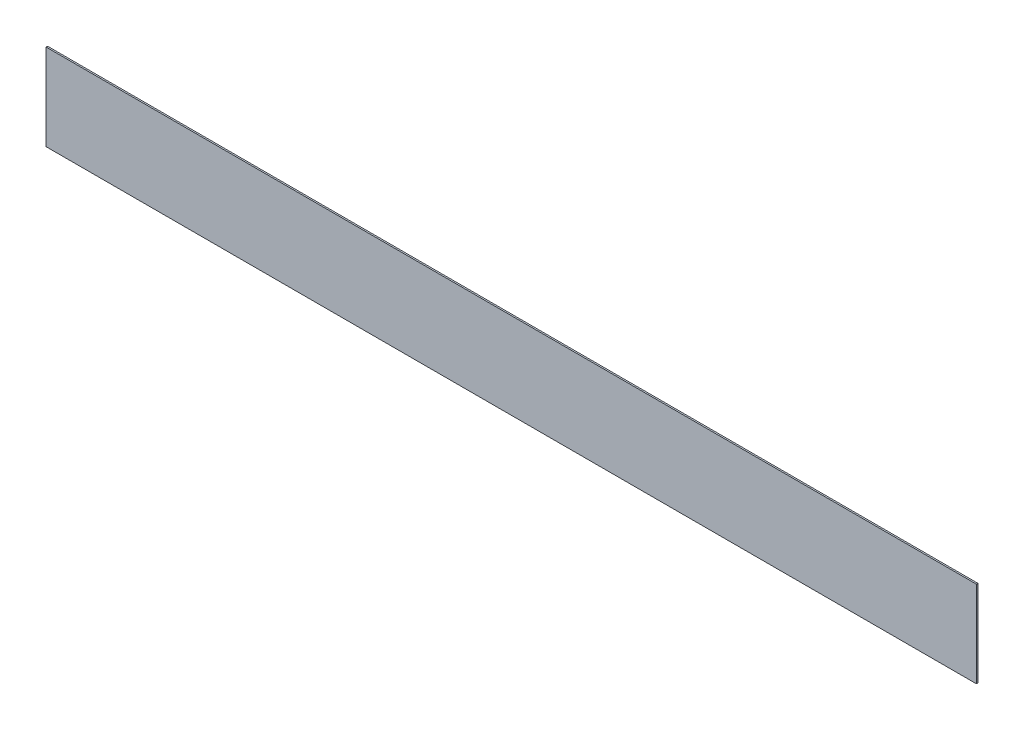
from build123d import *

# Parameters (mm, degrees)
SKETCH1_W           = 1240
SKETCH1_H           = 115
BOSS_EXTRUDE1_DEPTH = 2


with BuildPart() as part:
    # Sketch1 → Boss-Extrude1 (new body)
    with BuildSketch(Plane.XY):
        with Locations((620, 57.5)):
            Rectangle(SKETCH1_W, SKETCH1_H)
    extrude(amount=BOSS_EXTRUDE1_DEPTH)


solid = part.part
